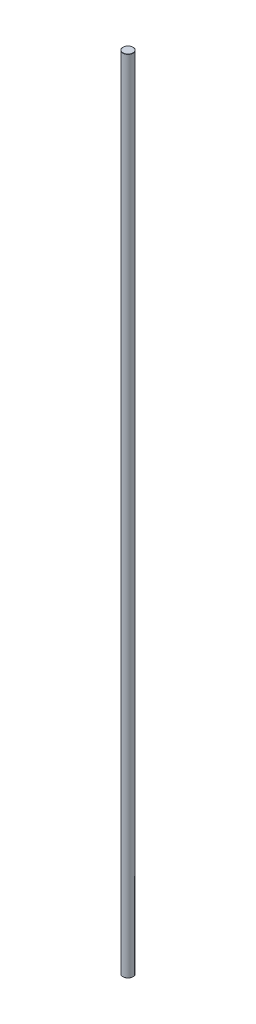
from build123d import *

# Parameters (mm, degrees)
SKETCH1_R           = 6.35
BOSS_EXTRUDE1_DEPTH = 495.3
CHAMFER1_SIZE       = 0.254


with BuildPart() as part:
    # Sketch1 → Boss-Extrude1 (new, symmetric)
    with BuildSketch(Plane(origin=(0, 0, 0), x_dir=(1, 0, 0), z_dir=(0, 1, 0))):
        with Locations(Location((0, 0, 0), (0, 0, 270))):
            Circle(SKETCH1_R)
    extrude(amount=BOSS_EXTRUDE1_DEPTH, both=True)

    # Chamfer1
    chamfer1_edges = [part.edges().sort_by_distance(p)[0] for p in [
        (0, -495.3, -6.35),
        (0, 495.3, -6.35),
    ]]
    chamfer(chamfer1_edges, length=CHAMFER1_SIZE)


solid = part.part
